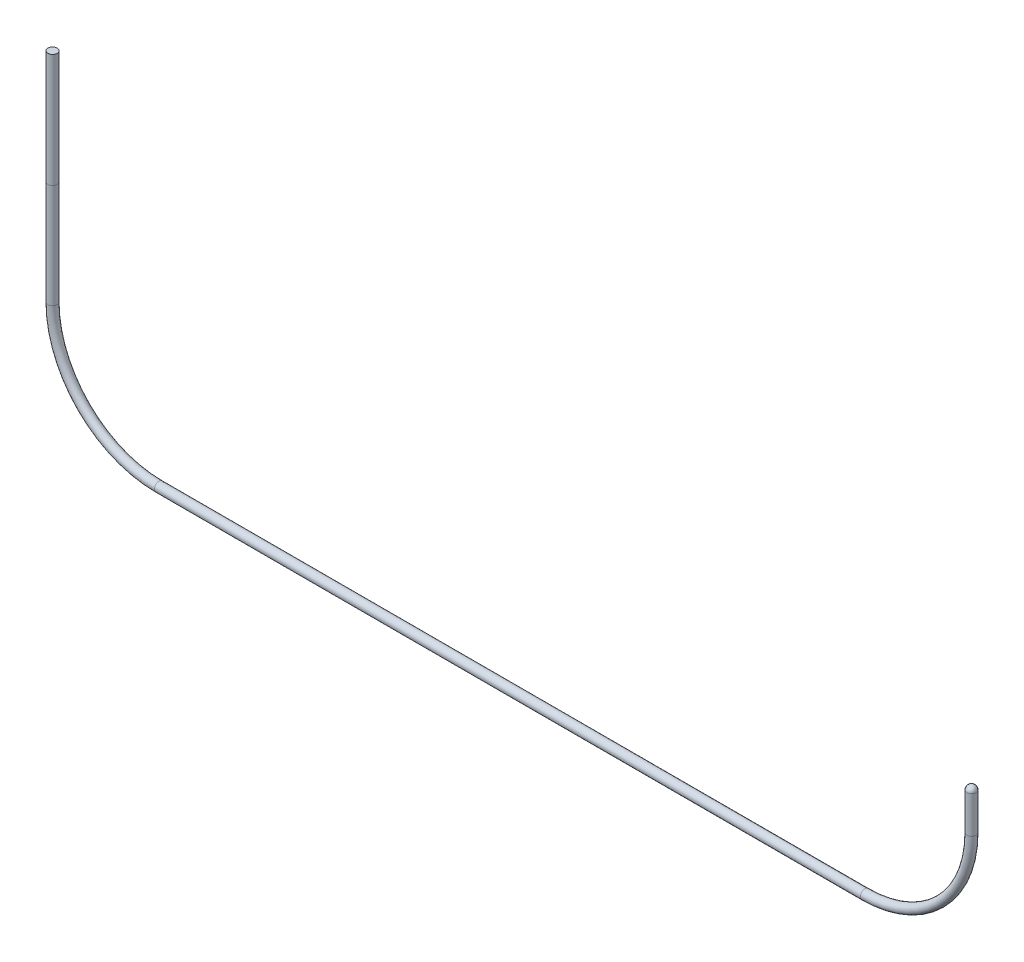
from build123d import *

# Parameters (mm, degrees)
SKETCH3_R = 0.1651
FILLET1_R = 0.1651


with BuildPart() as part:
    # Sweep1: sweep along a path in Sketch2
    with BuildLine(Plane.XY) as sweep1_path:
        Line((16.5989, -2.0066), (16.5989, -3.4925))
        ThreePointArc((16.5989, -3.4925), (15.434620166, -6.303320166), (12.6238, -7.4676))
        Line((12.6238, -7.4676), (-12.6238, -7.4676))
        ThreePointArc((-12.6238, -7.4676), (-15.434620166, -6.303320166), (-16.5989, -3.4925))
        Line((-16.5989, -3.4925), (-16.5989, 4.2926))
    # Sketch3 → Sweep1 (sweep)
    with BuildSketch(Plane(origin=(0, 4.2926, 0), x_dir=(-1, 0, 0), z_dir=(0, 1, 0))):
        with Locations((16.4338, 0)):
            Circle(SKETCH3_R)
    sweep(path=sweep1_path.line)

    # Fillet1
    fillet1_edges = [part.edges().sort_by_distance(p)[0] for p in [
        (16.2687, -2.0066, 0),
    ]]
    fillet(fillet1_edges, radius=FILLET1_R)


solid = part.part
